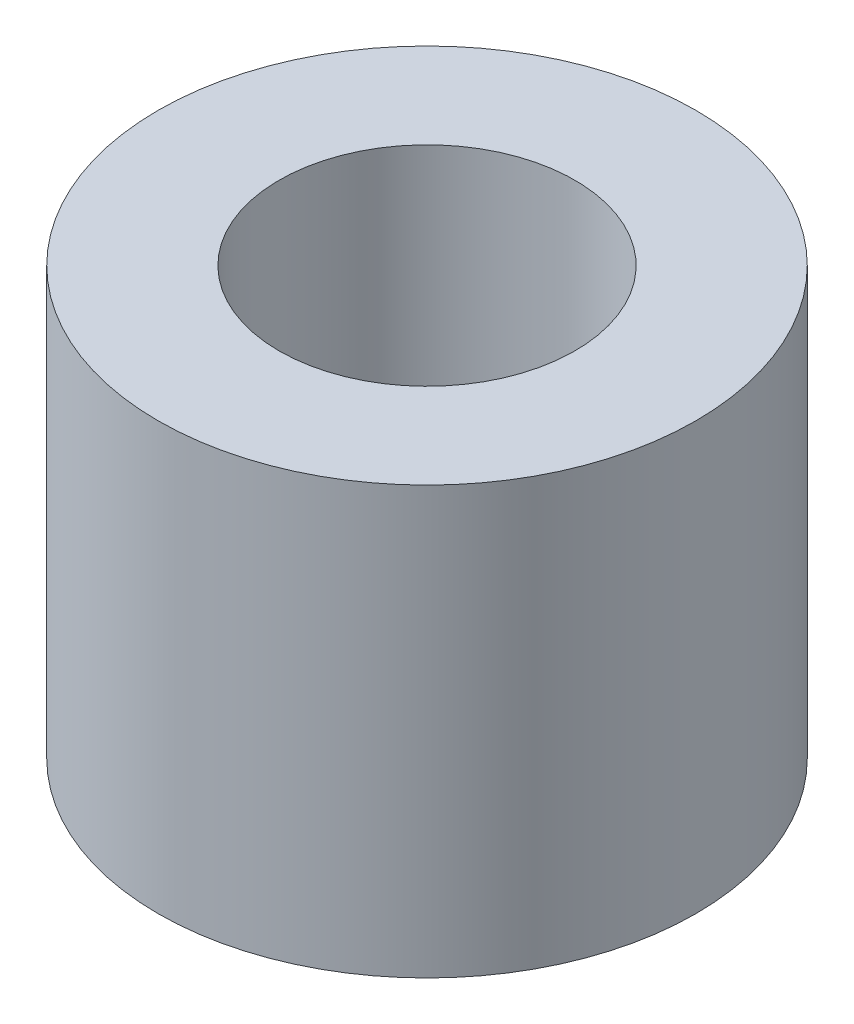
from build123d import *

# Parameters (mm, degrees)
SKETCH1_R           = 2
SKETCH1_R_2         = 1.1
BOSS_EXTRUDE1_DEPTH = 3.175


with BuildPart() as part:
    # Sketch1 → Boss-Extrude1 (new body)
    with BuildSketch(Plane(origin=(0, 0, 0), x_dir=(1, 0, 0), z_dir=(0, 1, 0))):
        with Locations(Location((0, 0, 0), (0, 0, 270))):
            Circle(SKETCH1_R)
        with Locations(Location((0, 0, 0), (0, 0, 270))):
            Circle(SKETCH1_R_2, mode=Mode.SUBTRACT)
    extrude(amount=BOSS_EXTRUDE1_DEPTH)


solid = part.part
